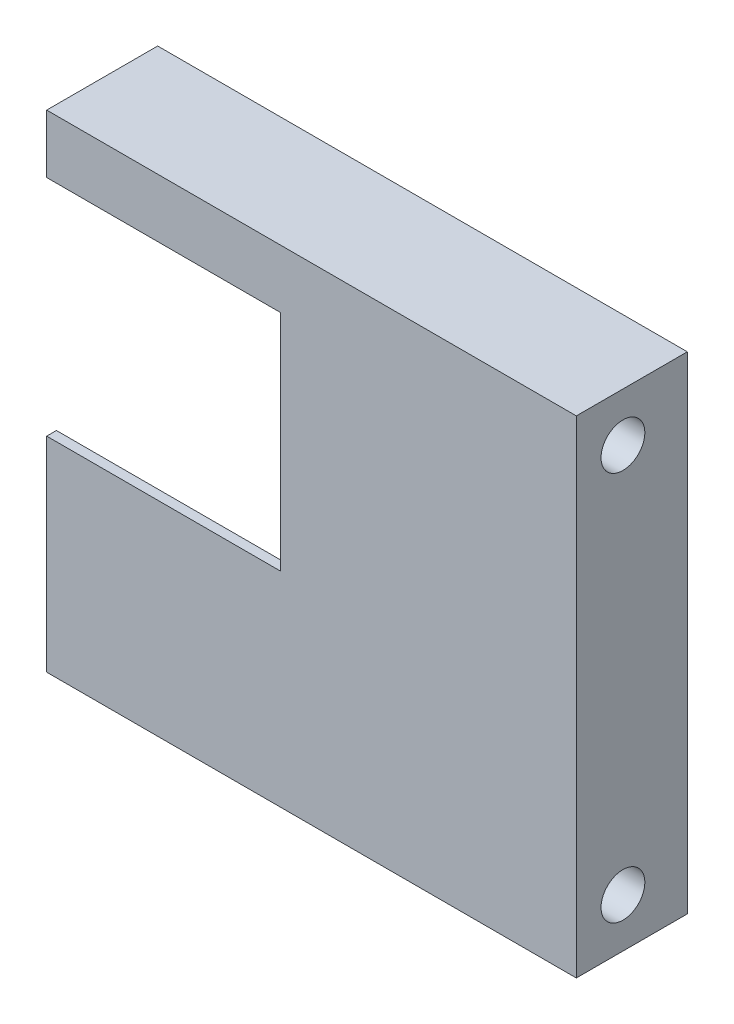
from build123d import *

# Parameters (mm, degrees)
BOSS_EXTRUDE1_DEPTH = 1
SKETCH2_W           = 50
SKETCH2_H           = 11.4
BOSS_EXTRUDE2_DEPTH = 4.4
SKETCH3_R           = 2.25
CUT_EXTRUDE1_DEPTH  = 4.4
SKETCH4_W           = 50
SKETCH4_H           = 5.5
BOSS_EXTRUDE3_DEPTH = 6.4
SKETCH5_W           = 50
SKETCH5_H           = 4.5
BOSS_EXTRUDE4_DEPTH = 2
SKETCH6_W           = 50
SKETCH6_H           = 5.5
BOSS_EXTRUDE5_DEPTH = 2


with BuildPart() as part:
    # Sketch1 → Boss-Extrude1 (new body)
    with BuildSketch(Plane(origin=(0, 0, 0), x_dir=(0, 1, 0), z_dir=(0, 0, 1))):
        Polygon((-4, 25), (-4, 1), (19, 1), (19, 25), (25, 25), (25, -25), (-25, -25), (-25, 25), align=None)
    extrude(amount=BOSS_EXTRUDE1_DEPTH)

    # Sketch2 → Boss-Extrude2 (add)
    with BuildSketch(Plane.YZ.offset(25)):
        with Locations((0, -4.7)):
            Rectangle(SKETCH2_W, SKETCH2_H)
    extrude(amount=BOSS_EXTRUDE2_DEPTH)

    # Sketch3 → Cut-Extrude1 (cut)
    with BuildSketch(Plane.YZ.offset(29.4)):
        with Locations(Location((-20, -3.787139035, 0), (0, 0, 270))):
            Circle(SKETCH3_R)
        with Locations(Location((20, -3.787139035, 0), (0, 0, 270))):
            Circle(SKETCH3_R)
    extrude(amount=-CUT_EXTRUDE1_DEPTH, mode=Mode.SUBTRACT)

    # Sketch4 → Boss-Extrude3 (add)
    with BuildSketch(Plane(origin=(0, 0, 0), x_dir=(1, 0, 0), z_dir=(0, 0, -1))):
        with Locations((0, -22.25)):
            Rectangle(SKETCH4_W, SKETCH4_H)
        with Locations((0, 22.25)):
            Rectangle(SKETCH4_W, SKETCH4_H)
    extrude(amount=BOSS_EXTRUDE3_DEPTH)

    # Sketch5 → Boss-Extrude4 (add)
    with BuildSketch(Plane(origin=(0, 0, -6.4), x_dir=(1, 0, 0), z_dir=(0, 0, -1))):
        with Locations((0, 22.75)):
            Rectangle(SKETCH5_W, SKETCH5_H)
        with Locations((0, -22.75)):
            Rectangle(SKETCH5_W, SKETCH5_H)
    extrude(amount=BOSS_EXTRUDE4_DEPTH)

    # Sketch6 → Boss-Extrude5 (add)
    with BuildSketch(Plane(origin=(0, 0, -8.4), x_dir=(1, 0, 0), z_dir=(0, 0, -1))):
        with Locations((0, 22.25)):
            Rectangle(SKETCH6_W, SKETCH6_H)
        with Locations((0, -22.25)):
            Rectangle(SKETCH6_W, SKETCH6_H)
    extrude(amount=BOSS_EXTRUDE5_DEPTH)


solid = part.part
